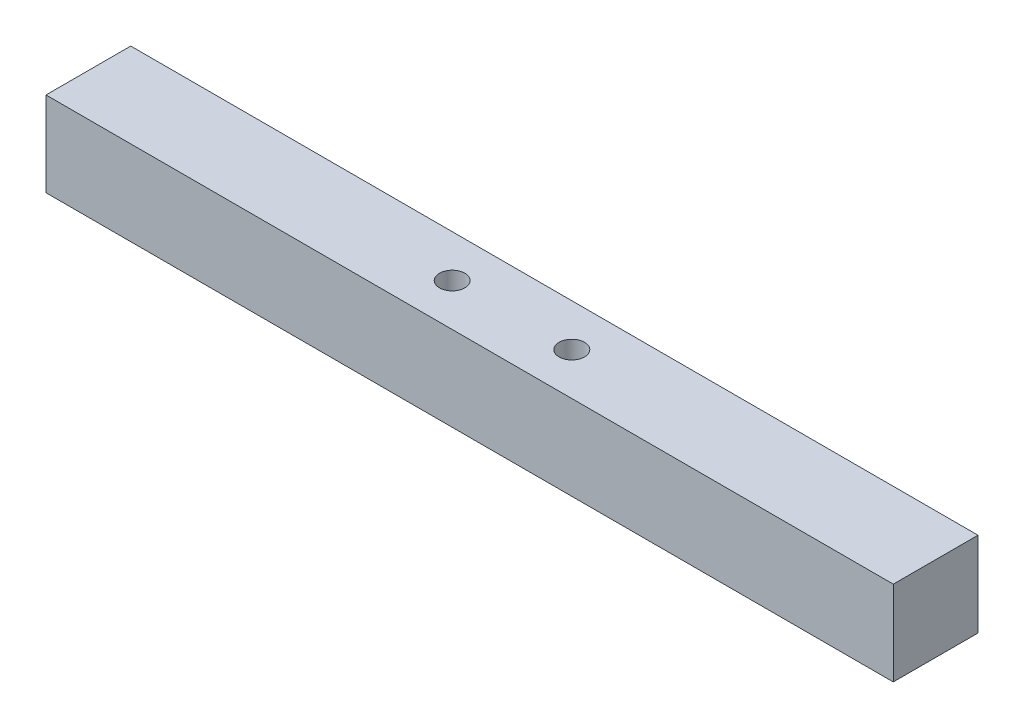
from build123d import *

# Parameters (mm, degrees)
SKIZZE1_W                       = 20
SKIZZE1_H                       = 20
AUFSATZ_LINEAR_AUSTRAGEN1_DEPTH = 200
SKIZZE2_R                       = 3
SCHNITT_LINEAR_AUSTRAGEN1_DEPTH = 202.246117975


with BuildPart() as part:
    # Skizze1 → Aufsatz-Linear austragen1 (new body)
    with BuildSketch(Plane(origin=(0, 0, 0), x_dir=(0, 0, -1), z_dir=(1, 0, 0))):
        Rectangle(SKIZZE1_W, SKIZZE1_H)
    extrude(amount=AUFSATZ_LINEAR_AUSTRAGEN1_DEPTH)

    # Skizze2 → Schnitt-Linear austragen1 (cut, through all)
    with BuildSketch(Plane(origin=(0, 10, 0), x_dir=(1, 0, 0), z_dir=(0, 1, 0))):
        with Locations(Location((85.88, 0, 0), (0, 0, 270))):
            Circle(SKIZZE2_R)
        with Locations(Location((114.12, 0, 0), (0, 0, 90))):
            Circle(SKIZZE2_R)
    extrude(amount=-SCHNITT_LINEAR_AUSTRAGEN1_DEPTH, mode=Mode.SUBTRACT)


solid = part.part
